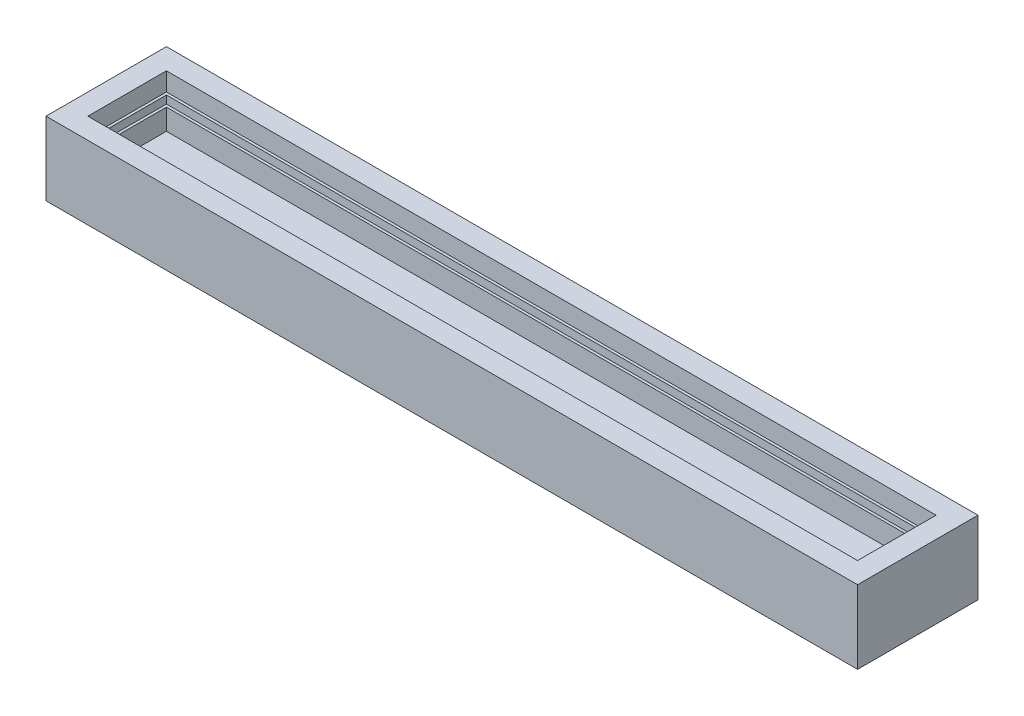
from build123d import *

# Parameters (mm, degrees)
SKIZZE1_W                       = 155
SKIZZE1_H                       = 23
SKIZZE1_W_2                     = 147
SKIZZE1_H_2                     = 15
AUFSATZ_LINEAR_AUSTRAGEN1_DEPTH = 10
SKIZZE3_W                       = 155
SKIZZE3_H                       = 23
AUFSATZ_LINEAR_AUSTRAGEN3_DEPTH = 4
SKIZZE4_W                       = 149
SKIZZE4_H                       = 17
SKIZZE4_W_2                     = 147
SKIZZE4_H_2                     = 15
SCHNITT_LINEAR_AUSTRAGEN1_DEPTH = 0.5
SKIZZE5_W                       = 149
SKIZZE5_H                       = 17
SCHNITT_LINEAR_AUSTRAGEN2_DEPTH = 0.5


with BuildPart() as part:
    # Skizze1 → Aufsatz-Linear austragen1 (new body)
    with BuildSketch(Plane(origin=(0, 0, 0), x_dir=(1, 0, 0), z_dir=(0, 1, 0))):
        Rectangle(SKIZZE1_W, SKIZZE1_H)
        Rectangle(SKIZZE1_W_2, SKIZZE1_H_2, mode=Mode.SUBTRACT)
    extrude(amount=AUFSATZ_LINEAR_AUSTRAGEN1_DEPTH)

    # Skizze3 → Aufsatz-Linear austragen3 (add)
    with BuildSketch(Plane.XZ):
        Rectangle(SKIZZE3_W, SKIZZE3_H)
    extrude(amount=AUFSATZ_LINEAR_AUSTRAGEN3_DEPTH)

    # Skizze4 → Schnitt-Linear austragen1 (cut)
    with BuildSketch(Plane(origin=(0, 4, 0), x_dir=(1, 0, 0), z_dir=(0, 1, 0))):
        Rectangle(SKIZZE4_W, SKIZZE4_H)
        Rectangle(SKIZZE4_W_2, SKIZZE4_H_2, mode=Mode.SUBTRACT)
    extrude(amount=SCHNITT_LINEAR_AUSTRAGEN1_DEPTH, mode=Mode.SUBTRACT)

    # Skizze5 → Schnitt-Linear austragen2 (cut)
    with BuildSketch(Plane(origin=(0, 6, 0), x_dir=(1, 0, 0), z_dir=(0, 1, 0))):
        Rectangle(SKIZZE5_W, SKIZZE5_H)
    extrude(amount=SCHNITT_LINEAR_AUSTRAGEN2_DEPTH, mode=Mode.SUBTRACT)


solid = part.part
